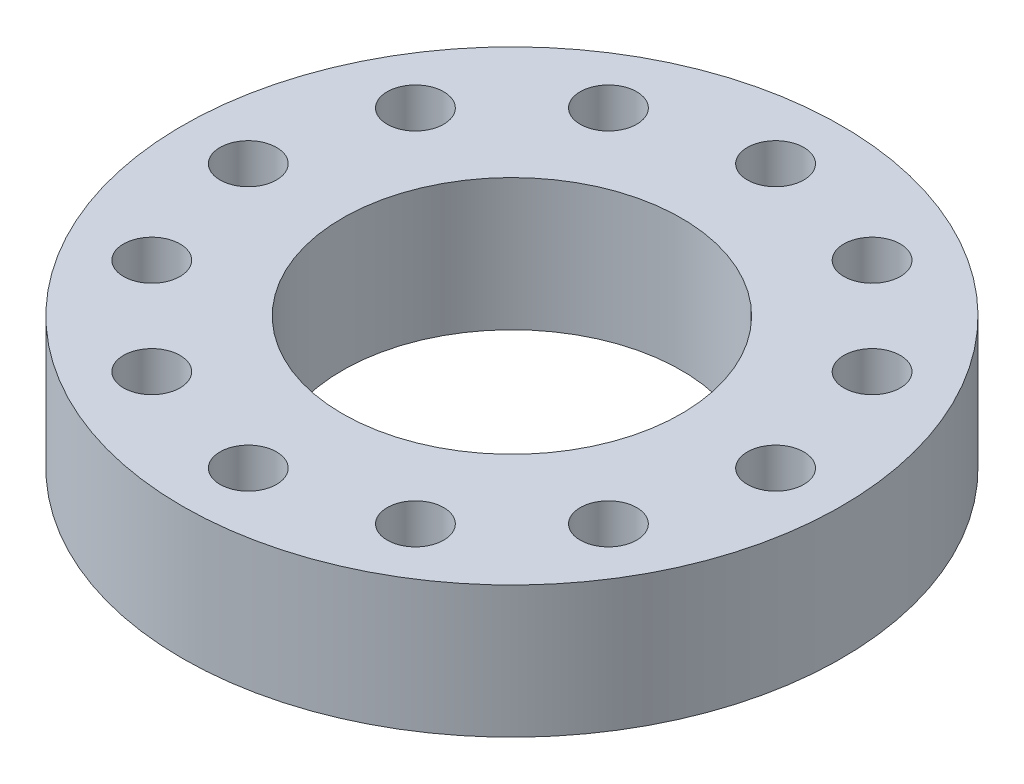
from build123d import *

# Parameters (mm, degrees)
SKETCH1_R           = 17.5
SKETCH1_R_2         = 9
SKETCH1_R_3         = 1.5
BOSS_EXTRUDE1_DEPTH = 7


with BuildPart() as part:
    # Sketch1 → Boss-Extrude1 (new body)
    with BuildSketch(Plane(origin=(0, 0, 0), x_dir=(1, 0, 0), z_dir=(0, 1, 0))):
        with Locations(Location((0, 0, 0), (0, 0, 270))):
            Circle(SKETCH1_R)
        with Locations(Location((0, 0, 0), (0, 0, 270))):
            Circle(SKETCH1_R_2, mode=Mode.SUBTRACT)
        with Locations(Location((0, 14, 0), (0, 0, 270))):
            Circle(SKETCH1_R_3, mode=Mode.SUBTRACT)
        with Locations(Location((7, 12.124355653, 0), (0, 0, 270))):
            Circle(SKETCH1_R_3, mode=Mode.SUBTRACT)
        with Locations(Location((12.124355653, 7, 0), (0, 0, 270))):
            Circle(SKETCH1_R_3, mode=Mode.SUBTRACT)
        with Locations(Location((14, 0, 0), (0, 0, 270))):
            Circle(SKETCH1_R_3, mode=Mode.SUBTRACT)
        with Locations(Location((12.124355653, -7, 0), (0, 0, 270))):
            Circle(SKETCH1_R_3, mode=Mode.SUBTRACT)
        with Locations(Location((7, -12.124355653, 0), (0, 0, 270))):
            Circle(SKETCH1_R_3, mode=Mode.SUBTRACT)
        with Locations(Location((0, -14, 0), (0, 0, 270))):
            Circle(SKETCH1_R_3, mode=Mode.SUBTRACT)
        with Locations(Location((-7, -12.124355653, 0), (0, 0, 270))):
            Circle(SKETCH1_R_3, mode=Mode.SUBTRACT)
        with Locations(Location((-12.124355653, -7, 0), (0, 0, 270))):
            Circle(SKETCH1_R_3, mode=Mode.SUBTRACT)
        with Locations(Location((-14, 0, 0), (0, 0, 270))):
            Circle(SKETCH1_R_3, mode=Mode.SUBTRACT)
        with Locations(Location((-12.124355653, 7, 0), (0, 0, 270))):
            Circle(SKETCH1_R_3, mode=Mode.SUBTRACT)
        with Locations(Location((-7, 12.124355653, 0), (0, 0, 270))):
            Circle(SKETCH1_R_3, mode=Mode.SUBTRACT)
    extrude(amount=BOSS_EXTRUDE1_DEPTH)


solid = part.part
